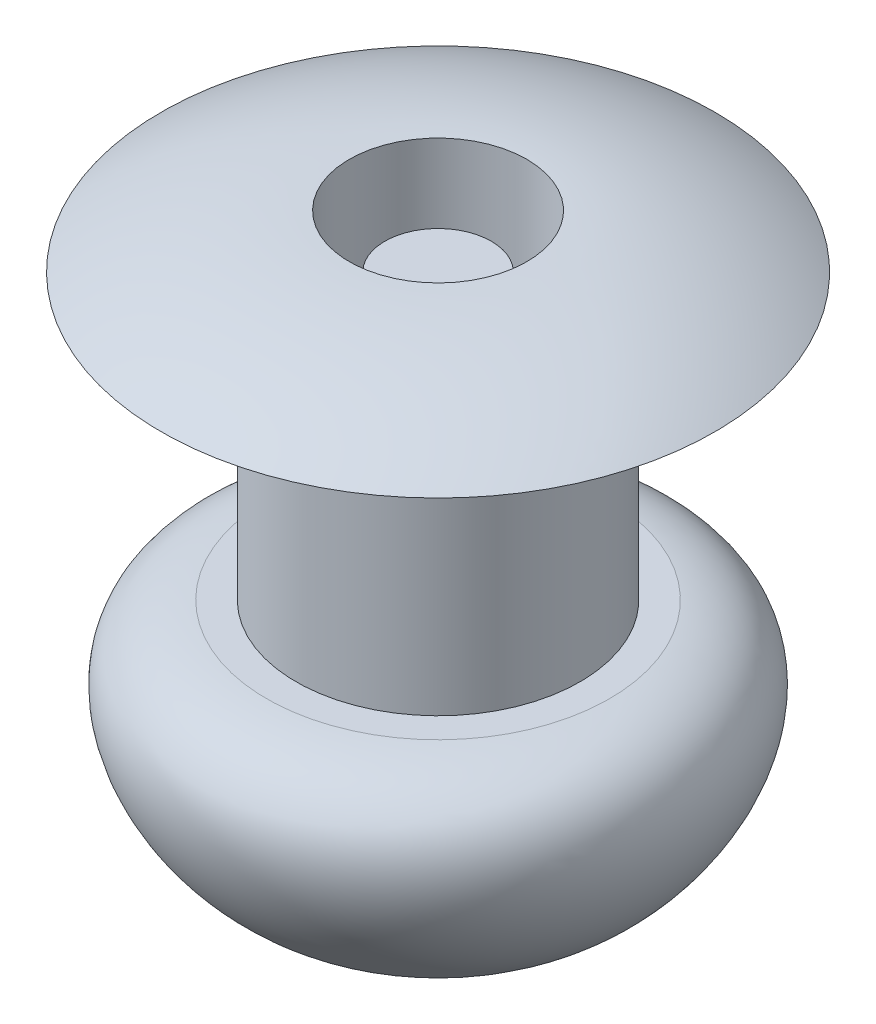
from build123d import *


with BuildPart() as part:
    # Szkic1 → Obrót1 (revolve)
    with BuildSketch(Plane(origin=(0, 0, 0), x_dir=(0, 0, -1), z_dir=(1, 0, 0)), mode=Mode.PRIVATE) as obr_t1_sk:
        with BuildLine():
            Line((0, 0), (0, -4))
            Line((0, -4), (0, -5.5))
            add(Edge.make_bspline(
                [(-0.956030427, -5.378190671), (-0.520263876, -5.5), (0, -5.5)],
                knots=[0.992852221, 0.992852221, 0.992852221, 1.570796327, 1.570796327, 1.570796327], degree=2, weights=[1, 0.958537313, 1]))
            add(Edge.make_bspline(
                [(-2.413891755, -4), (-3.858559437, -4.163296686), (-3.558358928, -6.322980362), (-0.971318098, -7.871940016), (-0.341145137, -5.79203191), (-0.956030427, -5.378190671)],
                knots=[0, 0, 0, 0, 0.454219308, 0.705200672, 1, 1, 1, 1], degree=3))
            Line((-2.413891755, -4), (-2, -4))
            Line((-2, -4), (-2, 0))
            Line((-2, 0), (-3.9, 0))
            ThreePointArc((-3.9, 0), (-2.627043935, 0.558888572), (-1.25, 0.75))
            Line((-1.25, 0.75), (-1.25, -4))
            Line((-1.25, -4), (-0.75, -4))
            Line((-0.75, -4), (-0.75, 0))
            Line((-0.75, 0), (0, 0))
        make_face()
    revolve(obr_t1_sk.sketch.rotate(Axis((0, 0, 0), (0, 1, 0)), 180), axis=Axis((0, 0, 0), (0, 1, 0)))


solid = part.part
